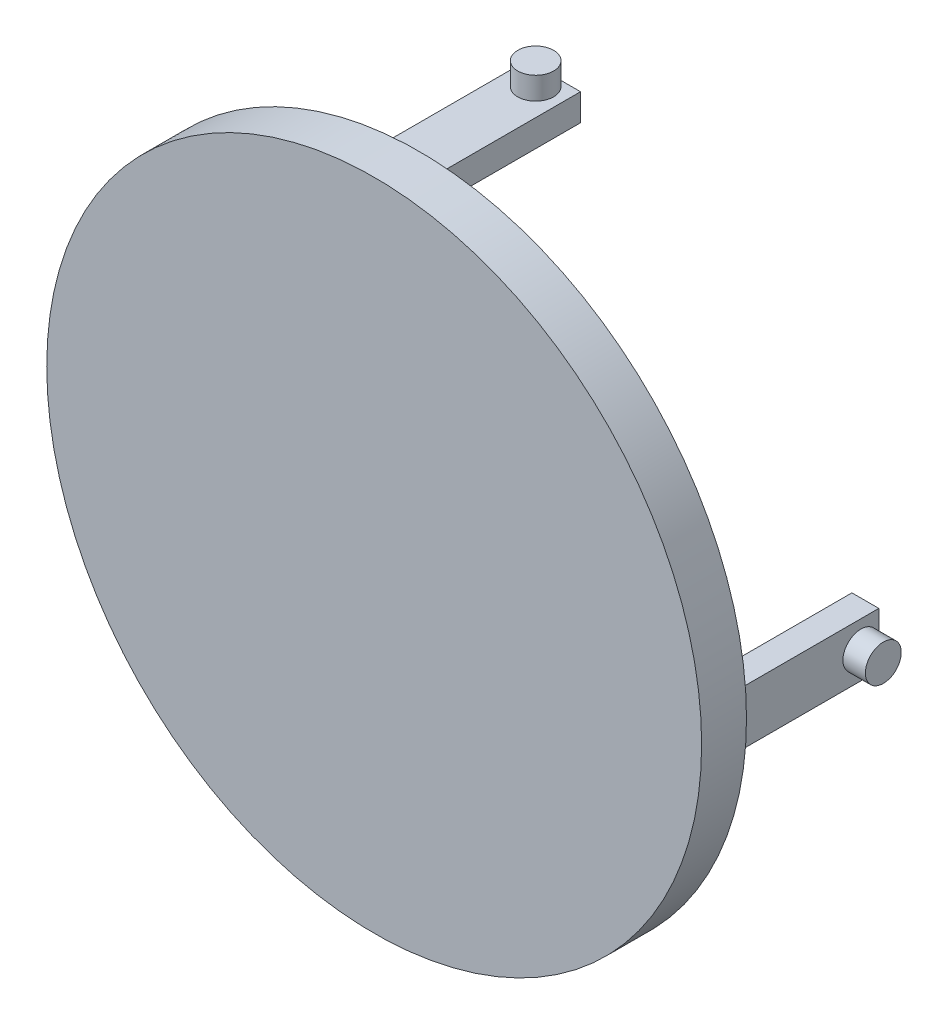
from build123d import *

# Parameters (mm, degrees)
SKETCH1_R            = 36.5
BOSS_EXTRUDE1_DEPTH  = 5
SKETCH4_W            = 3
SKETCH4_H            = 6
SKETCH4_W_2          = 6
SKETCH4_H_2          = 3
BOSS_EXTRUDE4_DEPTH  = 15
SKETCH6_R            = 2
BOSS_EXTRUDE6_DEPTH  = 2.5
SKETCH7_R            = 2
BOSS_EXTRUDE8_DEPTH  = 2.5
BOSS_EXTRUDE9_START  = -2.5
SKETCH9_R            = 2
BOSS_EXTRUDE9_DEPTH  = 2.5
BOSS_EXTRUDE10_START = -2.5
SKETCH10_R           = 2
BOSS_EXTRUDE10_DEPTH = 2.5


with BuildPart() as part:
    # Sketch1 → Boss-Extrude1 (new body)
    with BuildSketch(Plane.XY):
        Circle(SKETCH1_R)
    extrude(amount=BOSS_EXTRUDE1_DEPTH)

    # Sketch4 → Boss-Extrude4 (add)
    with BuildSketch(Plane(origin=(0, 0, 0), x_dir=(-1, 0, 0), z_dir=(0, 0, -1))):
        with Locations((-34.75, 0)):
            Rectangle(SKETCH4_W, SKETCH4_H)
        with Locations((34.75, 0)):
            Rectangle(SKETCH4_W, SKETCH4_H)
        with Locations((0, 34.75)):
            Rectangle(SKETCH4_W_2, SKETCH4_H_2)
        with Locations((0, -34.75)):
            Rectangle(SKETCH4_W_2, SKETCH4_H_2)
    extrude(amount=BOSS_EXTRUDE4_DEPTH)

    # Sketch6 → Boss-Extrude6 (add)
    with BuildSketch(Plane(origin=(36.25, 0, 0), x_dir=(0, 0, -1), z_dir=(1, 0, 0))):
        with Locations((13, 0)):
            Circle(SKETCH6_R)
    extrude(amount=BOSS_EXTRUDE6_DEPTH)

    # Sketch7 → Boss-Extrude8 (add)
    with BuildSketch(Plane(origin=(0, -36.25, -62.5), x_dir=(1, 0, 0), z_dir=(0, 1, 0))):
        with Locations(Location((0, -49.5, 0), (0, 0, 270))):
            Circle(SKETCH7_R)
    extrude(amount=-BOSS_EXTRUDE8_DEPTH)

    # Sketch9 → Boss-Extrude9 (add)
    with BuildSketch(Plane(origin=(-36.25, 0, -62.5), x_dir=(0, 0, -1), z_dir=(1, 0, 0)).offset(BOSS_EXTRUDE9_START)):
        with Locations((-49.5, 0)):
            Circle(SKETCH9_R)
    extrude(amount=BOSS_EXTRUDE9_DEPTH)

    # Sketch10 → Boss-Extrude10 (add)
    with BuildSketch(Plane(origin=(0, 36.25, 0), x_dir=(-1, 0, 0), z_dir=(0, -1, 0)).offset(BOSS_EXTRUDE10_START)):
        with Locations(Location((0, 13, 0), (0, 0, 270))):
            Circle(SKETCH10_R)
    extrude(amount=BOSS_EXTRUDE10_DEPTH)


solid = part.part
